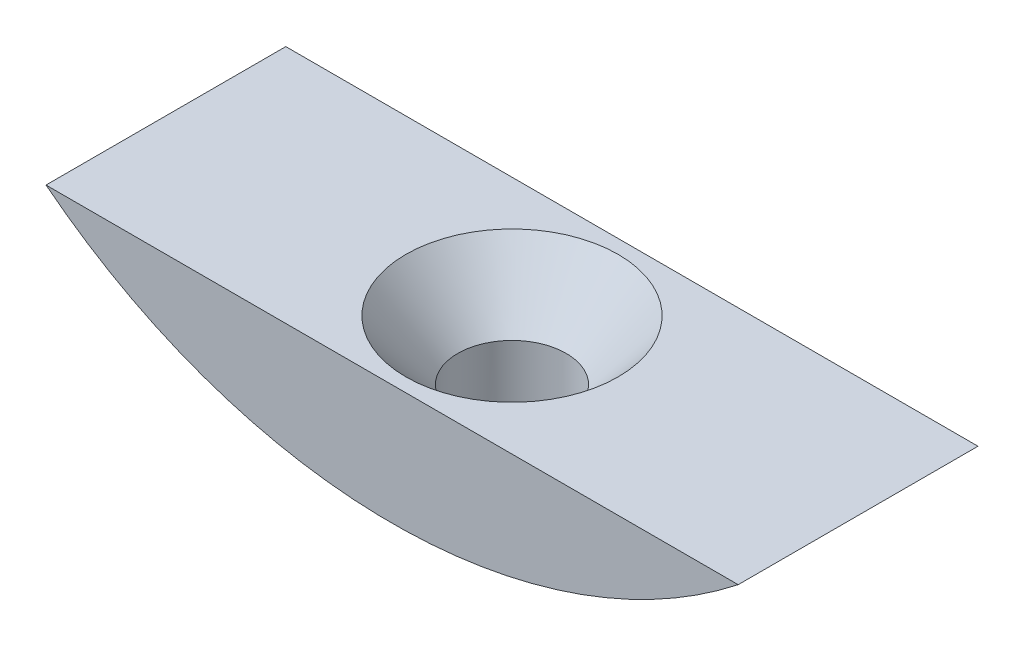
from build123d import *

# Parameters (mm, degrees)
BOSS_EXTRUDE1_DEPTH = 9.525


with BuildPart() as part:
    # Sketch1 → Boss-Extrude1 (new body)
    with BuildSketch(Plane.XY):
        with BuildLine():
            Line((-13.748153285, 0), (13.748153285, 0))
            ThreePointArc((13.748153285, 0), (0, -4.7625), (-13.748153285, 0))
        make_face()
    extrude(amount=-BOSS_EXTRUDE1_DEPTH)

    # Sketch6 → CSK for #8 Flat Head Machine Screw1 (revolve, cut)
    with BuildSketch(Plane(origin=(0, 0, -4.7625), x_dir=(0, 0, 1), z_dir=(1, 0, 0))):
        Polygon((0, 0), (0, 4.7625), (2.15265, 4.7625), (2.15265, 2.3740728), (4.2164, 0), align=None)
    revolve(axis=Axis((0, 6.35, -4.7625), (0, -1, 0)), mode=Mode.SUBTRACT)


solid = part.part
